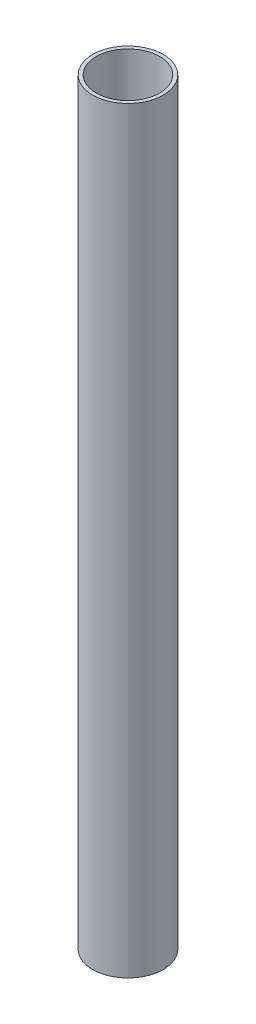
from build123d import *

# Parameters (mm, degrees)
SKETCH1_R           = 10
SKETCH1_R_2         = 9
BOSS_EXTRUDE1_DEPTH = 215


with BuildPart() as part:
    # Sketch1 → Boss-Extrude1 (new body)
    with BuildSketch(Plane(origin=(0, 0, 0), x_dir=(1, 0, 0), z_dir=(0, 1, 0))):
        with Locations(Location((0, 0, 0), (0, 0, 270))):
            Circle(SKETCH1_R)
        with Locations(Location((0, 0, 0), (0, 0, 270))):
            Circle(SKETCH1_R_2, mode=Mode.SUBTRACT)
    extrude(amount=BOSS_EXTRUDE1_DEPTH)


solid = part.part
